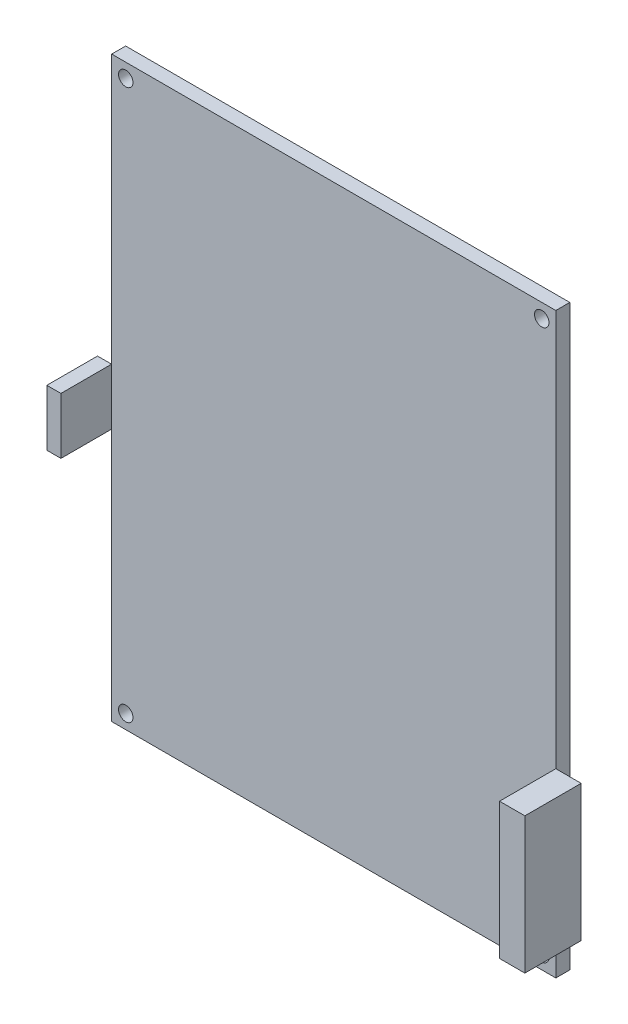
from build123d import *

# Parameters (mm, degrees)
SKETCH1_W                      = 100.203
SKETCH1_H                      = 130.429
EXTRUDE1_DEPTH                 = 3.1496
SKETCH3_W                      = 11.43
SKETCH3_H                      = 12.7
EXTRUDE3_DEPTH                 = 3.175
SKETCH6_W                      = 12.7
SKETCH6_H                      = 30.734
EXTRUDE4_DEPTH                 = 5.715
SKETCH5_W                      = 1.63195
SKETCH5_H                      = 3.1496
F_4_CLEARANCE_HOLE1_AT_2_COUNT = 2
F_4_CLEARANCE_HOLE1_AT_2_PITCH = 124.079
MIRROR1_COPY_1_SKETCH_W        = 1.63195
MIRROR1_COPY_1_SKETCH_H        = 3.1496


with BuildPart() as part:
    # Sketch1 → Extrude1 (new body)
    with BuildSketch(Plane.XY):
        Rectangle(SKETCH1_W, SKETCH1_H)
    extrude(amount=EXTRUDE1_DEPTH)

    # Sketch5 → #4 Clearance Hole1 (revolve, cut)
    with BuildSketch(Plane(origin=(-46.9265, 62.0395, 3.1496), x_dir=(0, -1, 0), z_dir=(1, 0, 0))):
        with Locations((0.815975, 1.5748)):
            Rectangle(SKETCH5_W, SKETCH5_H)
    f_4_clearance_hole1 = revolve(axis=Axis((-46.9265, 62.0395, 9.4996), (0, 0, -1)), mode=Mode.SUBTRACT)

    # #4 Clearance Hole1 at 2: #4 Clearance Hole1 ×2
    with Locations(*[(0, -i * F_4_CLEARANCE_HOLE1_AT_2_PITCH, 0) for i in range(1, F_4_CLEARANCE_HOLE1_AT_2_COUNT)]):
        add(f_4_clearance_hole1, mode=Mode.SUBTRACT)

    # Mirror1: #4 Clearance Hole1 across plane
    add(f_4_clearance_hole1.mirror(Plane(origin=(0, 0, 0), x_dir=(0, 0, 1), z_dir=(1, 0, 0))), mode=Mode.SUBTRACT)

    # Mirror1 copy 1 sketch → Mirror1 copy 1 (revolve, cut)
    with BuildSketch(Plane(origin=(46.9265, -62.0395, 3.1496), x_dir=(0, -1, 0), z_dir=(-1, 0, 0))):
        with Locations((0.815975, -1.5748)):
            Rectangle(MIRROR1_COPY_1_SKETCH_W, MIRROR1_COPY_1_SKETCH_H)
    revolve(axis=Axis((46.9265, -62.0395, 9.4996), (0, 0, 1)), mode=Mode.SUBTRACT)


with BuildPart() as body_2:
    # Sketch3 → Extrude3 (new body)
    with BuildSketch(Plane.ZY.offset(50.1015)):
        with Locations((8.89, -1.7145)):
            Rectangle(SKETCH3_W, SKETCH3_H)
    extrude(amount=EXTRUDE3_DEPTH)


with BuildPart() as body_3:
    # Sketch6 → Extrude4 (new body)
    with BuildSketch(Plane(origin=(50.1015, 0, 0), x_dir=(0, 0, -1), z_dir=(1, 0, 0))):
        with Locations((-9.4996, -39.6875)):
            Rectangle(SKETCH6_W, SKETCH6_H)
    extrude(amount=EXTRUDE4_DEPTH)


solid = Compound([part.part, body_2.part, body_3.part])
